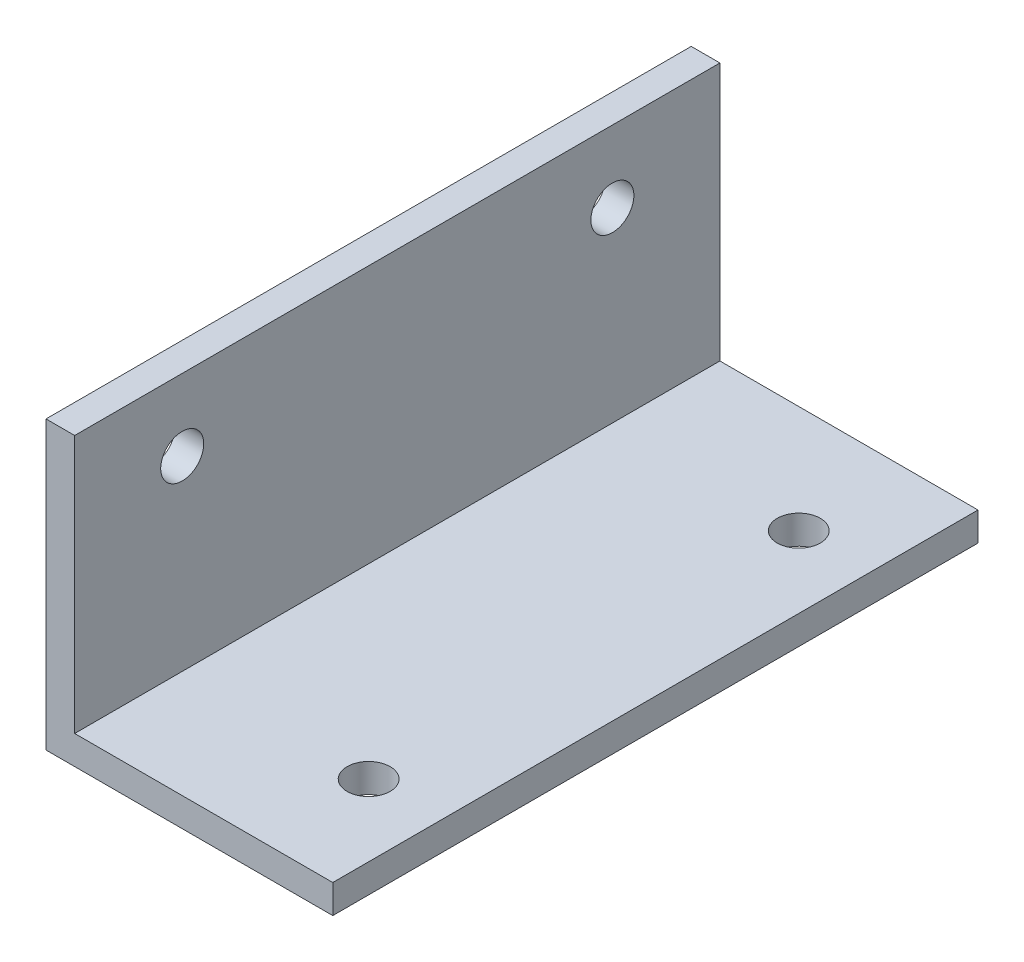
from build123d import *

# Parameters (mm, degrees)
EXTRUDE_1_DEPTH     = 45
SKETCH_2_R          = 1.5
CUT_EXTRUDE_1_DEPTH = 52.701063819
SKETCH_3_R          = 1.5
CUT_EXTRUDE_2_DEPTH = 52.701063819


with BuildPart() as part:
    # 草图1 → 凸台-拉伸1 (new body)
    with BuildSketch(Plane.XY):
        Polygon((0, 0), (0, 18), (-2, 18), (-2, -2), (18, -2), (18, 0), align=None)
    extrude(amount=EXTRUDE_1_DEPTH)

    # 草图2 → 切除-拉伸1 (cut, through all)
    with BuildSketch(Plane(origin=(0, 0, 0), x_dir=(0, 0, -1), z_dir=(1, 0, 0))):
        with Locations((-37.5, 13)):
            Circle(SKETCH_2_R)
        with Locations(Location((-7.5, 13, 0), (0, 0, 180))):
            Circle(SKETCH_2_R)
    extrude(amount=-CUT_EXTRUDE_1_DEPTH, mode=Mode.SUBTRACT)

    # 草图3 → 切除-拉伸2 (cut, through all)
    with BuildSketch(Plane(origin=(0, 0, 0), x_dir=(1, 0, 0), z_dir=(0, 1, 0))):
        with Locations(Location((13, -37.5, 0), (0, 0, 180))):
            Circle(SKETCH_3_R)
        with Locations((13, -7.5)):
            Circle(SKETCH_3_R)
    extrude(amount=-CUT_EXTRUDE_2_DEPTH, mode=Mode.SUBTRACT)


solid = part.part
